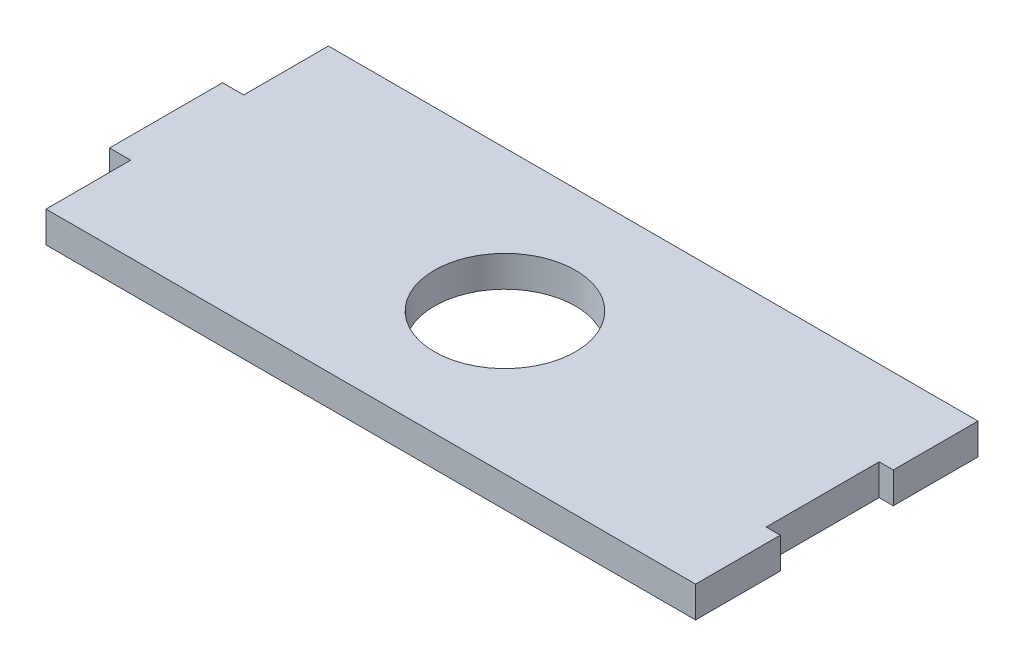
from build123d import *

# Parameters (mm, degrees)
SKETCH1_R           = 5
BOSS_EXTRUDE1_DEPTH = 2.2


with BuildPart() as part:
    # Sketch1 → Boss-Extrude1 (new body)
    with BuildSketch(Plane(origin=(0, 0, 0), x_dir=(1, 0, 0), z_dir=(0, 1, 0))):
        Polygon((-138.804574569, 30.597712716), (-138.804574569, 22.597712716), (-137.304574569, 22.597712716), (-137.304574569, 16.597712716), (-91.304574569, 16.597712716), (-91.304574569, 22.597712716), (-92.304574569, 22.597712716), (-92.304574569, 30.597712716), (-91.304574569, 30.597712716), (-91.304574569, 36.597712716), (-137.304574569, 36.597712716), (-137.304574569, 30.597712716), align=None)
        with Locations(Location((-114.805151385, 26.597712716, 0), (0, 0, 270))):
            Circle(SKETCH1_R, mode=Mode.SUBTRACT)
    extrude(amount=BOSS_EXTRUDE1_DEPTH)


solid = part.part
